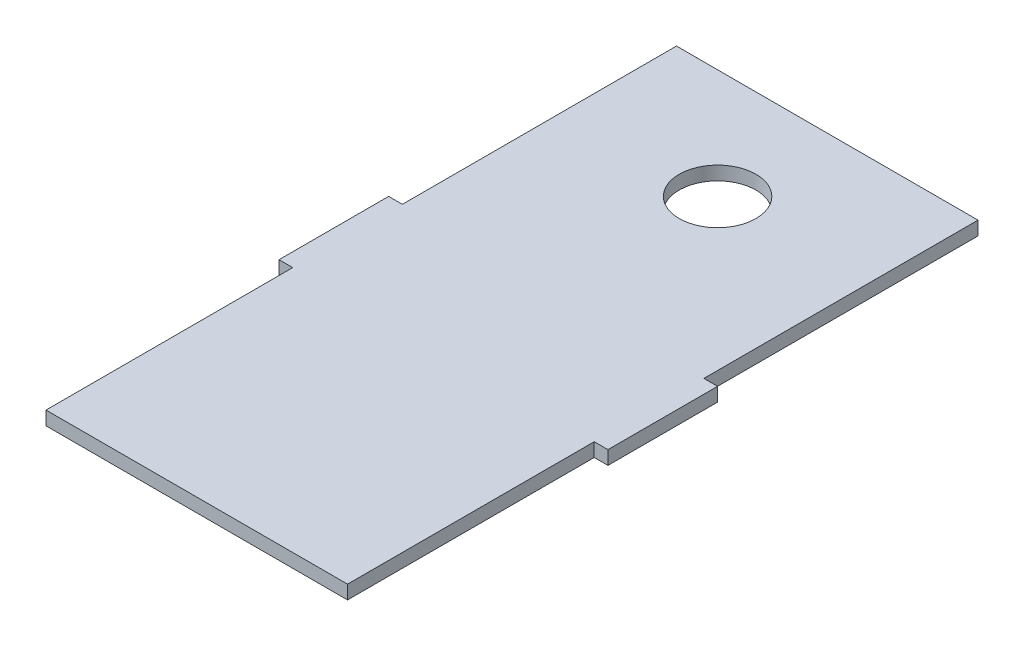
from build123d import *

# Parameters (mm, degrees)
SKETCH1_W           = 76.2
SKETCH1_H           = 146.05
SKETCH1_R           = 8.89
BOSS_EXTRUDE1_DEPTH = 3.175
SKETCH2_W           = 3.175
SKETCH2_H           = 57.15
SKETCH2_H_2         = 63.5
CUT_EXTRUDE1_DEPTH  = 3.175


with BuildPart() as part:
    # Sketch1 → Boss-Extrude1 (new body)
    with BuildSketch(Plane(origin=(0, 0, 0), x_dir=(1, 0, 0), z_dir=(0, 1, 0))):
        with Locations((38.1, 73.025)):
            Rectangle(SKETCH1_W, SKETCH1_H)
        with Locations(Location((38.1, 120.65, 0), (0, 0, 270))):
            Circle(SKETCH1_R, mode=Mode.SUBTRACT)
    extrude(amount=BOSS_EXTRUDE1_DEPTH)

    # Sketch2 → Cut-Extrude1 (cut)
    with BuildSketch(Plane(origin=(0, 3.175, 0), x_dir=(1, 0, 0), z_dir=(0, 1, 0))):
        with Locations((1.5875, 28.575)):
            Rectangle(SKETCH2_W, SKETCH2_H)
        with Locations((1.5875, 114.3)):
            Rectangle(SKETCH2_W, SKETCH2_H_2)
        with Locations((74.6125, 114.3)):
            Rectangle(SKETCH2_W, SKETCH2_H_2)
        with Locations((74.6125, 28.575)):
            Rectangle(SKETCH2_W, SKETCH2_H)
    extrude(amount=-CUT_EXTRUDE1_DEPTH, mode=Mode.SUBTRACT)


solid = part.part
